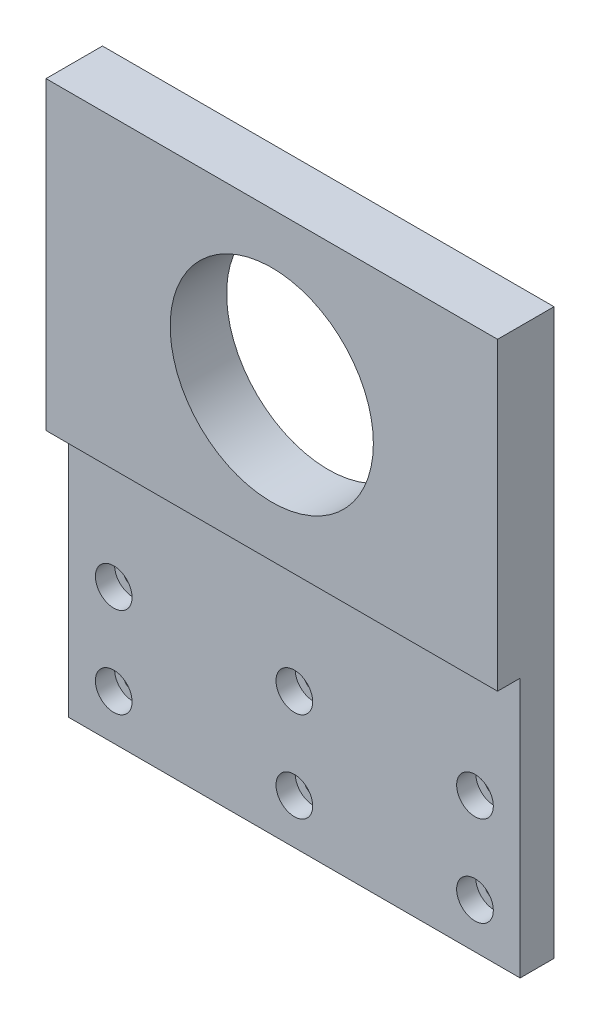
from build123d import *

# Parameters (mm, degrees)
SKETCH1_W                                           = 80
SKETCH1_H                                           = 100
BOSS_EXTRUDE1_DEPTH                                 = 10
SKETCH2_R                                           = 18
CUT_EXTRUDE1_DEPTH                                  = 129.452325787
SKETCH3_W                                           = 80
SKETCH3_H                                           = 46
CUT_EXTRUDE2_DEPTH                                  = 4
CBORE_FOR_M3_HEX_SOCKET_HEAD_CAP_SCREW1_D           = 3.4
CBORE_FOR_M3_HEX_SOCKET_HEAD_CAP_SCREW1_CBORE_D     = 6.5
CBORE_FOR_M3_HEX_SOCKET_HEAD_CAP_SCREW1_CBORE_DEPTH = 3.4


with BuildPart() as part:
    # Sketch1 → Boss-Extrude1 (new body)
    with BuildSketch(Plane.XY):
        with Locations((40, 50)):
            Rectangle(SKETCH1_W, SKETCH1_H)
    extrude(amount=BOSS_EXTRUDE1_DEPTH)

    # Sketch2 → Cut-Extrude1 (cut, through all)
    with BuildSketch(Plane.XY.offset(10)):
        with Locations((40, 73)):
            Circle(SKETCH2_R)
    extrude(amount=-CUT_EXTRUDE1_DEPTH, mode=Mode.SUBTRACT)

    # Sketch3 → Cut-Extrude2 (cut)
    with BuildSketch(Plane.XY.offset(10)):
        with Locations((40, 23)):
            Rectangle(SKETCH3_W, SKETCH3_H)
    extrude(amount=-CUT_EXTRUDE2_DEPTH, mode=Mode.SUBTRACT)

    # CBORE for M3 Hex Socket Head Cap Screw1 (through all)
    with Locations(Plane.XY.offset(6)):
        with Locations((8, 8), (40, 8), (72, 8), (40, 24), (72, 24), (8, 24)):
            CounterBoreHole(CBORE_FOR_M3_HEX_SOCKET_HEAD_CAP_SCREW1_D / 2, CBORE_FOR_M3_HEX_SOCKET_HEAD_CAP_SCREW1_CBORE_D / 2, CBORE_FOR_M3_HEX_SOCKET_HEAD_CAP_SCREW1_CBORE_DEPTH)


solid = part.part
